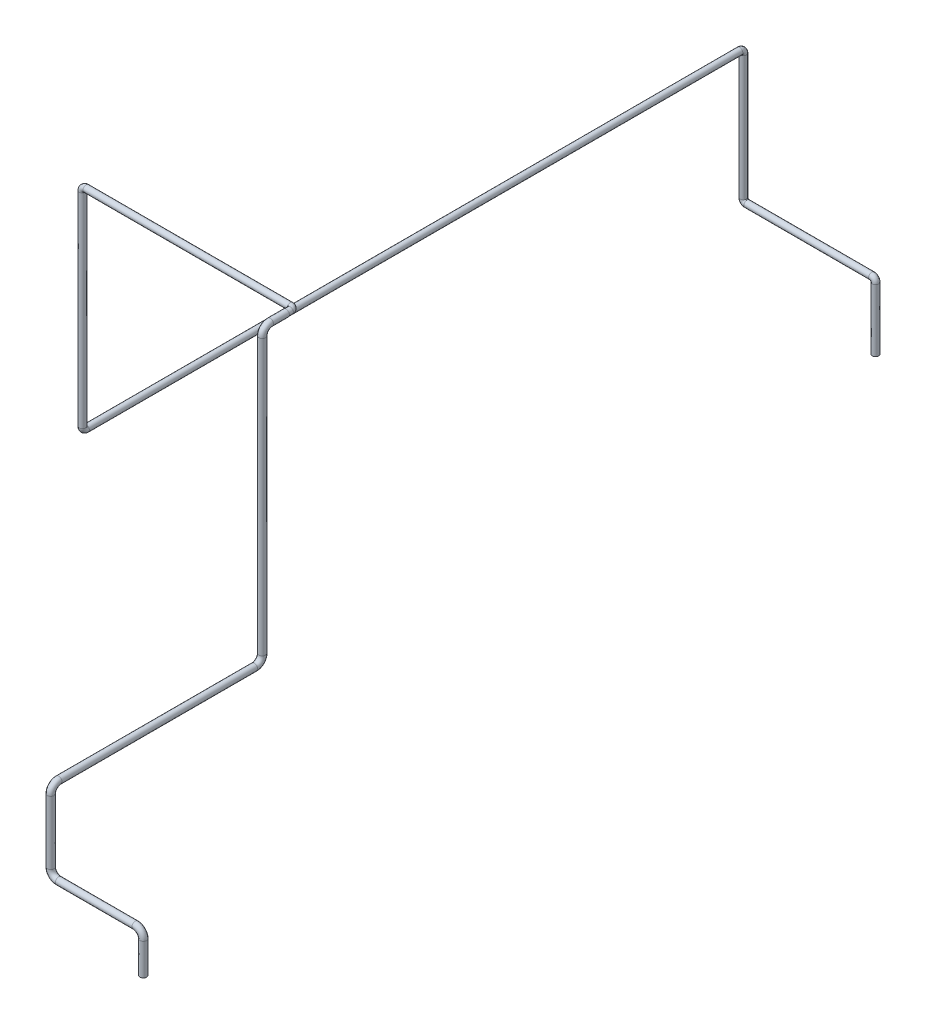
from build123d import *

# Parameters (mm, degrees)
CROQUIS1_R              = 12.7
SALIENTE_EXTRUIR1_DEPTH = 20
CROQUIS2_R              = 12.7
CROQUIS3_R              = 12


with BuildPart() as part:
    # Croquis1 → Saliente-Extruir1 (new body)
    with BuildSketch(Plane.XY):
        Circle(CROQUIS1_R)
    extrude(amount=SALIENTE_EXTRUIR1_DEPTH)

    # Barrer1: sweep along a curve in space
    with BuildLine() as barrer1_path:
        Line((0, 0, 20), (0, 0, 60))
        ThreePointArc((0, 0, 60), (0, -8.786796564, 81.213203436), (0, -30, 90))
        Line((0, -30, 90), (0, -1070, 90))
        ThreePointArc((0, -1070, 90), (0, -1091.213203436, 98.786796564), (0, -1100, 120))
        Line((0, -1100, 120), (0, -1100, 860))
        ThreePointArc((0, -1100, 860), (0, -1108.786796564, 881.213203436), (0, -1130, 890))
        Line((0, -1130, 890), (0, -1370, 890))
        ThreePointArc((0, -1370, 890), (8.786796564, -1391.213203436, 890), (30, -1400, 890))
        Line((30, -1400, 890), (320, -1400, 890))
        ThreePointArc((320, -1400, 890), (341.213203436, -1408.786796564, 890), (350, -1430, 890))
        Line((350, -1430, 890), (350, -1550, 890))
    # Croquis2 → Barrer1 (sweep)
    with BuildSketch(Plane.XY.offset(20)):
        Circle(CROQUIS2_R)
    sweep(path=barrer1_path.line)

    # Barrer2: sweep along a curve in space
    with BuildLine() as barrer2_path:
        Line((0, 0, 0), (0, 0, -16))
        ThreePointArc((0, 0, -16), (-4.100505063, 0, -25.899494937), (-14, 0, -30))
        Line((-14, 0, -30), (-786, 0, -30))
        ThreePointArc((-786, 0, -30), (-795.899494937, -4.100505063, -30), (-800, -14, -30))
        Line((-800, -14, -30), (-800, -786, -30))
        ThreePointArc((-800, -786, -30), (-800, -795.899494937, -34.100505063), (-800, -800, -44))
        Line((-800, -800, -44), (-800, -800, -2516))
        ThreePointArc((-800, -800, -2516), (-800, -804.100505063, -2525.899494937), (-800, -814, -2530))
        Line((-800, -814, -2530), (-800, -1286, -2530))
        ThreePointArc((-800, -1286, -2530), (-795.899494937, -1295.899494937, -2530), (-786, -1300, -2530))
        Line((-786, -1300, -2530), (-314, -1300, -2530))
        ThreePointArc((-314, -1300, -2530), (-304.100505063, -1304.100505063, -2530), (-300, -1314, -2530))
        Line((-300, -1314, -2530), (-300, -1550, -2530))
    # Croquis3 → Barrer2 (sweep)
    with BuildSketch(Plane(origin=(0, 0, 0), x_dir=(-1, 0, 0), z_dir=(0, 0, -1))):
        Circle(CROQUIS3_R)
    sweep(path=barrer2_path.line)


solid = part.part
